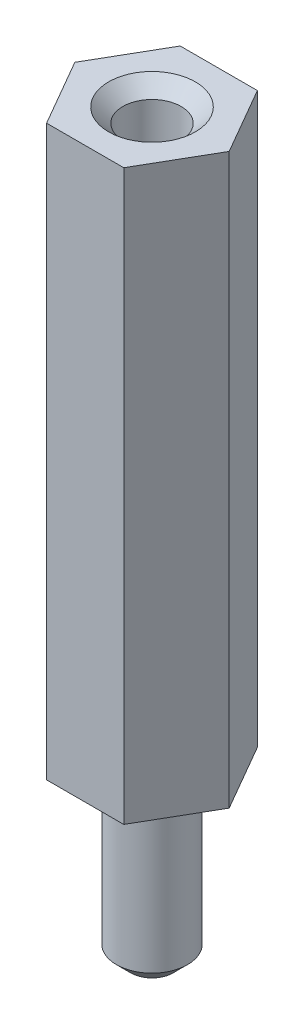
from build123d import *

# Parameters (mm, degrees)
BOSS_EXTRUDE1_DEPTH                = 20
SKETCH2_W                          = 1.25
SKETCH2_H                          = 6
TAP_DRILL_FOR_M2_5X0_45_TAP1_D     = 2.05
TAP_DRILL_FOR_M2_5X0_45_TAP1_DEPTH = 19
CHAMFER1_SIZE                      = 0.5


with BuildPart() as part:
    # Sketch1 → Boss-Extrude1 (new body)
    with BuildSketch(Plane(origin=(0, 20, 0), x_dir=(1, 0, 0), z_dir=(0, 1, 0))):
        Polygon((1.356773133, -2.35), (2.713546265, 0), (1.356773133, 2.35), (-1.356773133, 2.35), (-2.713546265, 0), (-1.356773133, -2.35), align=None)
    extrude(amount=-BOSS_EXTRUDE1_DEPTH)

    # Sketch2 → Revolve1 (revolve)
    with BuildSketch(Plane(origin=(0, 0, 0), x_dir=(-1, 0, 0), z_dir=(0, 0, -1)), mode=Mode.PRIVATE) as revolve1_sk:
        with Locations((-0.625, -3)):
            Rectangle(SKETCH2_W, SKETCH2_H)
    revolve(revolve1_sk.sketch.rotate(Axis((0, -6, 0), (0, 1, 0)), 270), axis=Axis((0, -6, 0), (0, 1, 0)))

    # Tap Drill for M2.5x0.45 Tap1
    with Locations(Plane(origin=(0, 20, 0), x_dir=(1, 0, 0), z_dir=(0, 1, 0))):
        with Locations((0, 0)):
            Hole(TAP_DRILL_FOR_M2_5X0_45_TAP1_D / 2, depth=TAP_DRILL_FOR_M2_5X0_45_TAP1_DEPTH)

    # Chamfer1
    chamfer1_edges = [part.edges().sort_by_distance(p)[0] for p in [
        (0, -6, -1.25),
        (1.025, 20, 0),
    ]]
    chamfer(chamfer1_edges, length=CHAMFER1_SIZE)


solid = part.part
